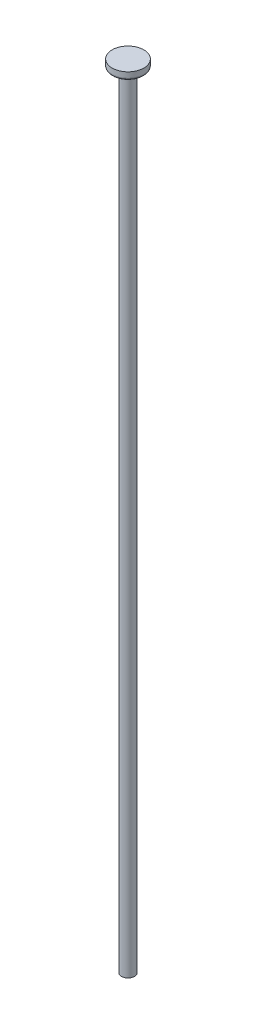
from build123d import *

# Parameters (mm, degrees)
SKETCH1_R           = 0.889
BOSS_EXTRUDE1_DEPTH = 107.95
SKETCH2_R           = 2.159
BOSS_EXTRUDE2_DEPTH = 1.016
FILLET1_R           = 0.254


with BuildPart() as part:
    # Sketch1 → Boss-Extrude1 (new body)
    with BuildSketch(Plane(origin=(0, 0, 0), x_dir=(1, 0, 0), z_dir=(0, 1, 0))):
        with Locations(Location((0, 0, 0), (0, 0, 270))):
            Circle(SKETCH1_R)
    extrude(amount=BOSS_EXTRUDE1_DEPTH)

    # Sketch2 → Boss-Extrude2 (add)
    with BuildSketch(Plane(origin=(0, 107.95, 0), x_dir=(1, 0, 0), z_dir=(0, 1, 0))):
        with Locations(Location((0, 0, 0), (0, 0, 270))):
            Circle(SKETCH2_R)
    extrude(amount=-BOSS_EXTRUDE2_DEPTH)

    # Fillet1
    fillet1_edges = [part.edges().sort_by_distance(p)[0] for p in [
        (0, 106.934, -2.159),
    ]]
    fillet(fillet1_edges, radius=FILLET1_R)


solid = part.part
